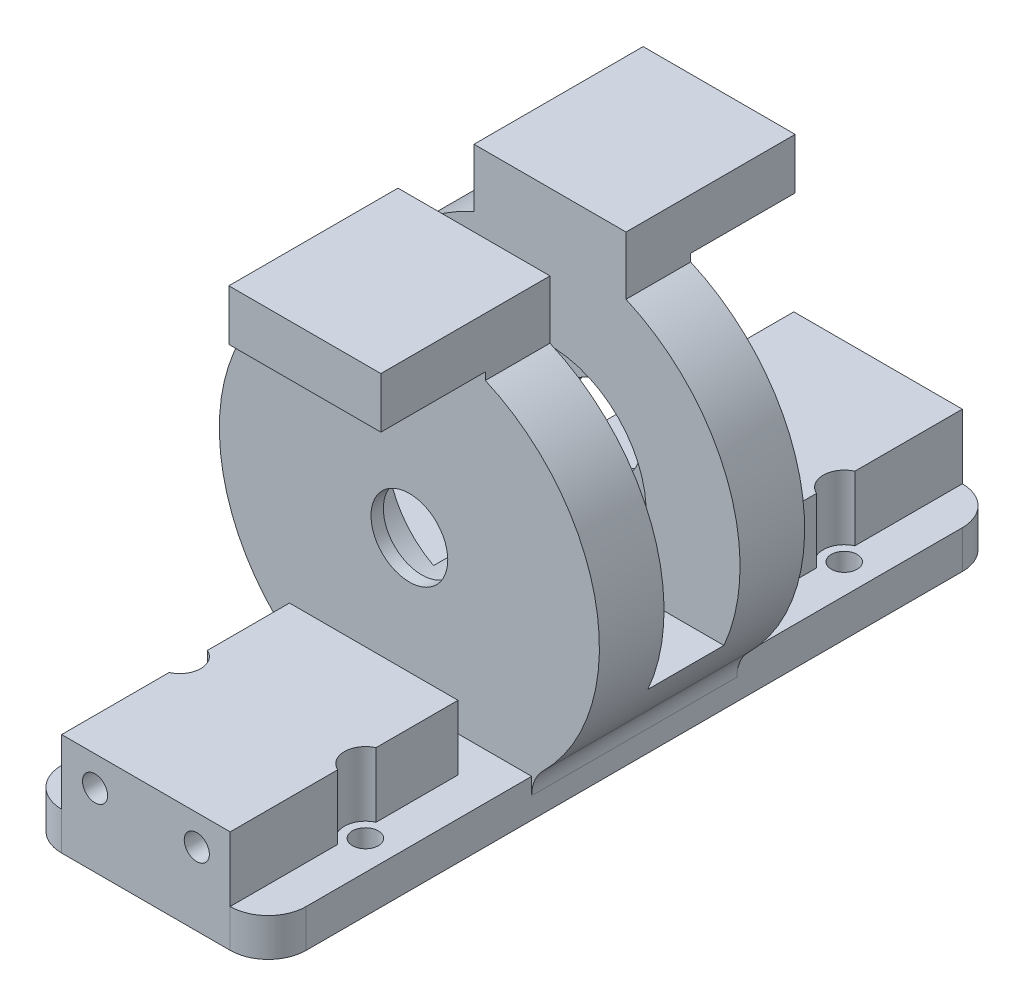
from build123d import *

# Parameters (mm, degrees)
SKETCH1_R                      = 6.4135
BOSS_EXTRUDE1_DEPTH            = 34.29
CUT_EXTRUDE1_REACH             = 100.106
SKETCH3_W                      = 12.7
SKETCH3_H                      = 51.6425
CUT_EXTRUDE1_DIRECTION_2_REACH = 100.106
SKETCH5_R                      = 2.159
CUT_EXTRUDE2_DEPTH             = 86.858993575
SKETCH6_W                      = 25.4
SKETCH6_H                      = 8.47980016
BOSS_EXTRUDE2_DEPTH            = 17.4625
CUT_EXTRUDE9_START             = -6.35
SKETCH12_R                     = 14.478
CUT_EXTRUDE9_DEPTH             = 15.08125
FILLET4_R                      = 6.35
CHAMFER1_SIZE                  = 1.5875
CUT_EXTRUDE13_DEPTH            = 95.203417847
SKETCH16_W                     = 40.857524936
SKETCH16_H                     = 6.35
BOSS_EXTRUDE3_DEPTH            = 61.16
SKETCH17_R                     = 2.159
CUT_EXTRUDE14_DEPTH            = 6.35
FILLET5_R                      = 6.35
SKETCH18_W                     = 28.157524936
SKETCH18_H                     = 38.06
BOSS_EXTRUDE4_DEPTH            = 10.8
SKETCH19_R                     = 2.1
CUT_EXTRUDE15_DEPTH            = 40
SKETCH21_R                     = 3.5
CUT_EXTRUDE16_DEPTH            = 11
SKETCH22_R                     = 3.5
CUT_EXTRUDE17_DEPTH            = 11


with BuildPart() as part:
    # Sketch1 → Boss-Extrude1 (new body)
    # profile 1 of 3: a face of its own
    with BuildSketch(Plane.XY):
        with BuildLine():
            Line((12.7, 6.75), (20.428762468, 6.75))
            ThreePointArc((20.428762468, 6.75), (31.422640825, 35.602442589), (12.7, 60.154255663))
            Line((12.7, 60.154255663), (12.7, 6.75))
        make_face()
    # profile 2 of 3: a face of its own
    with BuildSketch(Plane.XY):
        Polygon((-47, 0.4), (-10.625, 0.4), (10.625, 0.4), (47, 0.4), (47, 6.75), (12.7, 6.75), (12.7, 69.8924), (-12.7, 69.8924), (-12.7, 6.75), (-47, 6.75), align=None)
        with Locations((0, 31.0549)):
            Circle(SKETCH1_R, mode=Mode.SUBTRACT)
    # profile 3 of 3: a face of its own
    with BuildSketch(Plane.XY):
        with BuildLine():
            ThreePointArc((-12.7, 60.154255663), (-31.422640825, 35.602442589), (-20.428762468, 6.75))
            Line((-20.428762468, 6.75), (-12.7, 6.75))
            Line((-12.7, 6.75), (-12.7, 60.154255663))
        make_face()
    extrude(amount=BOSS_EXTRUDE1_DEPTH)

    # Sketch3 → Cut-Extrude1 (cut, up to next)
    with BuildSketch(Plane(origin=(12.7, 0, 0), x_dir=(0, 0, -1), z_dir=(1, 0, 0)), mode=Mode.PRIVATE) as cut_extrude1_sk1:
        with Locations((-17.145, 44.07115)):
            Rectangle(SKETCH3_W, SKETCH3_H)
    cut_extrude1_tool1 = extrude(cut_extrude1_sk1.sketch, amount=-CUT_EXTRUDE1_REACH, mode=Mode.PRIVATE) & part.part
    add(cut_extrude1_tool1.solids().sort_by_distance((12.7, 44.07115, 17.145))[0], mode=Mode.SUBTRACT)

    # Sketch3 → Cut-Extrude1 direction 2 (cut, up to next)
    with BuildSketch(Plane(origin=(12.7, 0, 0), x_dir=(0, 0, -1), z_dir=(1, 0, 0)), mode=Mode.PRIVATE) as cut_extrude1_direction_2_sk1:
        with Locations((-17.145, 44.07115)):
            Rectangle(SKETCH3_W, SKETCH3_H)
    cut_extrude1_direction_2_tool1 = extrude(cut_extrude1_direction_2_sk1.sketch, amount=CUT_EXTRUDE1_DIRECTION_2_REACH, mode=Mode.PRIVATE) & part.part
    add(cut_extrude1_direction_2_tool1.solids().sort_by_distance((12.7, 44.07115, 17.145))[0], mode=Mode.SUBTRACT)

    # Sketch5 → Cut-Extrude2 (cut, through all)
    with BuildSketch(Plane(origin=(0, 6.75, 0), x_dir=(1, 0, 0), z_dir=(0, 1, 0))):
        with Locations(Location((40, -27.94, 0), (0, 0, 180))):
            Circle(SKETCH5_R)
        with Locations(Location((40, -6.35, 0), (0, 0, 180))):
            Circle(SKETCH5_R)
        with Locations(Location((-40, -6.35, 0), (0, 0, 180))):
            Circle(SKETCH5_R)
        with Locations(Location((-40, -27.94, 0), (0, 0, 180))):
            Circle(SKETCH5_R)
    extrude(amount=-CUT_EXTRUDE2_DEPTH, mode=Mode.SUBTRACT)

    # Sketch6 → Boss-Extrude2 (add)
    with BuildSketch(Plane.XY.offset(34.29)):
        with Locations((0, 65.65249992)):
            Rectangle(SKETCH6_W, SKETCH6_H)
    boss_extrude2 = extrude(amount=BOSS_EXTRUDE2_DEPTH)

    # Sketch12 → Cut-Extrude9 (cut)
    with BuildSketch(Plane.XY.offset(23.495).offset(CUT_EXTRUDE9_START)):
        with Locations((0, 31.0549)):
            Circle(SKETCH12_R)
    cut_extrude9 = extrude(amount=CUT_EXTRUDE9_DEPTH, mode=Mode.SUBTRACT)

    # Mirror4: Boss-Extrude2, Cut-Extrude9 across plane
    add(boss_extrude2.mirror(Plane(origin=(0, 0, 17.145), x_dir=(1, 0, 0), z_dir=(0, 0, -1))))
    add(cut_extrude9.mirror(Plane(origin=(0, 0, 17.145), x_dir=(1, 0, 0), z_dir=(0, 0, -1))), mode=Mode.SUBTRACT)

    # Fillet4
    fillet4_edges = [part.edges().sort_by_distance(p)[0] for p in [
        (47, 3.575, 0),
        (-47, 3.575, 0),
        (-47, 3.575, 34.29),
        (47, 3.575, 34.29),
    ]]
    fillet(fillet4_edges, radius=FILLET4_R)

    # Chamfer1
    chamfer1_edges = [part.edges().sort_by_distance(p)[0] for p in [
        (-7.476567629, 43.453021652, 10.795),
    ]]
    chamfer(chamfer1_edges, length=CHAMFER1_SIZE)

    # Sketch15 → Cut-Extrude13 (cut, through all)
    with BuildSketch(Plane(origin=(0, 6.75, 0), x_dir=(1, 0, 0), z_dir=(0, 1, 0))):
        with BuildLine():
            Line((20.428762468, 1.013392391), (20.428762468, -35.303392391))
            ThreePointArc((20.428762468, -35.303392391), (22.863261605, -34.54592678), (25.4, -34.29))
            Line((25.4, -34.29), (40.65, -34.29))
            ThreePointArc((40.65, -34.29), (45.140128061, -32.430128061), (47, -27.94))
            Line((47, -27.94), (47, -6.35))
            ThreePointArc((47, -6.35), (45.140128061, -1.859871939), (40.65, 0))
            Line((40.65, 0), (25.4, 0))
            ThreePointArc((25.4, 0), (22.863261605, 0.25592678), (20.428762468, 1.013392391))
        make_face()
        with BuildLine():
            Line((-40.65, 0), (-25.4, 0))
            ThreePointArc((-25.4, 0), (-22.863261605, 0.25592678), (-20.428762468, 1.013392391))
            Line((-20.428762468, 1.013392391), (-20.428762468, -35.303392391))
            ThreePointArc((-20.428762468, -35.303392391), (-22.863261605, -34.54592678), (-25.4, -34.29))
            Line((-25.4, -34.29), (-40.65, -34.29))
            ThreePointArc((-40.65, -34.29), (-45.140128061, -32.430128061), (-47, -27.94))
            Line((-47, -27.94), (-47, -6.35))
            ThreePointArc((-47, -6.35), (-45.140128061, -1.859871939), (-40.65, 0))
        make_face()
    extrude(amount=-CUT_EXTRUDE13_DEPTH, mode=Mode.SUBTRACT)

    # Sketch16 → Boss-Extrude3 (add, symmetric)
    with BuildSketch(Plane(origin=(0, 0, 17.145), x_dir=(-1, 0, 0), z_dir=(0, 0, -1))):
        with Locations((0, 3.575)):
            Rectangle(SKETCH16_W, SKETCH16_H)
    extrude(amount=BOSS_EXTRUDE3_DEPTH, both=True)

    # Sketch17 → Cut-Extrude14 (cut)
    with BuildSketch(Plane.XZ.offset(-0.4)):
        with Locations((15.5, 57.145)):
            Circle(SKETCH17_R)
        with Locations((-15.5, 57.145)):
            Circle(SKETCH17_R)
        with Locations((15.5, -22.855)):
            Circle(SKETCH17_R)
        with Locations((-15.5, -22.855)):
            Circle(SKETCH17_R)
    extrude(amount=-CUT_EXTRUDE14_DEPTH, mode=Mode.SUBTRACT)

    # Fillet5
    fillet5_edges = [part.edges().sort_by_distance(p)[0] for p in [
        (-20.428762468, 6.75, 17.145),
        (20.428762468, 6.75, 17.145),
        (-20.428762468, 3.575, -44.015),
        (20.428762468, 3.575, -44.015),
        (-20.428762468, 3.575, 78.305),
        (20.428762468, 3.575, 78.305),
    ]]
    fillet(fillet5_edges, radius=FILLET5_R)

    # Sketch18 → Boss-Extrude4 (add)
    with BuildSketch(Plane(origin=(0, 6.75, 0), x_dir=(1, 0, 0), z_dir=(0, 1, 0))):
        with Locations((0, -59.275)):
            Rectangle(SKETCH18_W, SKETCH18_H)
    boss_extrude4 = extrude(amount=BOSS_EXTRUDE4_DEPTH)

    # Mirror5: Boss-Extrude4 across plane
    add(boss_extrude4.mirror(Plane(origin=(0, 0, 17.145), x_dir=(1, 0, 0), z_dir=(0, 0, -1))))

    # Sketch19 → Cut-Extrude15 (cut)
    with BuildSketch(Plane(origin=(0, 0, -44.015), x_dir=(-1, 0, 0), z_dir=(0, 0, -1))):
        with Locations((8.5, 12.5549)):
            Circle(SKETCH19_R)
        with Locations((-8.5, 12.5549)):
            Circle(SKETCH19_R)
    cut_extrude15 = extrude(amount=-CUT_EXTRUDE15_DEPTH, mode=Mode.SUBTRACT)

    # Mirror6: Cut-Extrude15 across plane
    add(cut_extrude15.mirror(Plane(origin=(0, 0, 17.145), x_dir=(1, 0, 0), z_dir=(0, 0, -1))), mode=Mode.SUBTRACT)

    # Sketch21 → Cut-Extrude16 (cut)
    with BuildSketch(Plane(origin=(0, 6.75, 0), x_dir=(1, 0, 0), z_dir=(0, 1, 0))):
        with Locations((15.5, -57.145)):
            Circle(SKETCH21_R)
    cut_extrude16 = extrude(amount=CUT_EXTRUDE16_DEPTH, mode=Mode.SUBTRACT)

    # Sketch22 → Cut-Extrude17 (cut)
    with BuildSketch(Plane(origin=(0, 6.75, 0), x_dir=(1, 0, 0), z_dir=(0, 1, 0))):
        with Locations((-15.5, -57.145)):
            Circle(SKETCH22_R)
    cut_extrude17 = extrude(amount=CUT_EXTRUDE17_DEPTH, mode=Mode.SUBTRACT)

    # Mirror7: Cut-Extrude16, Cut-Extrude17 across plane
    add(cut_extrude16.mirror(Plane(origin=(0, 0, 17.145), x_dir=(1, 0, 0), z_dir=(0, 0, -1))), mode=Mode.SUBTRACT)
    add(cut_extrude17.mirror(Plane(origin=(0, 0, 17.145), x_dir=(1, 0, 0), z_dir=(0, 0, -1))), mode=Mode.SUBTRACT)


solid = part.part
